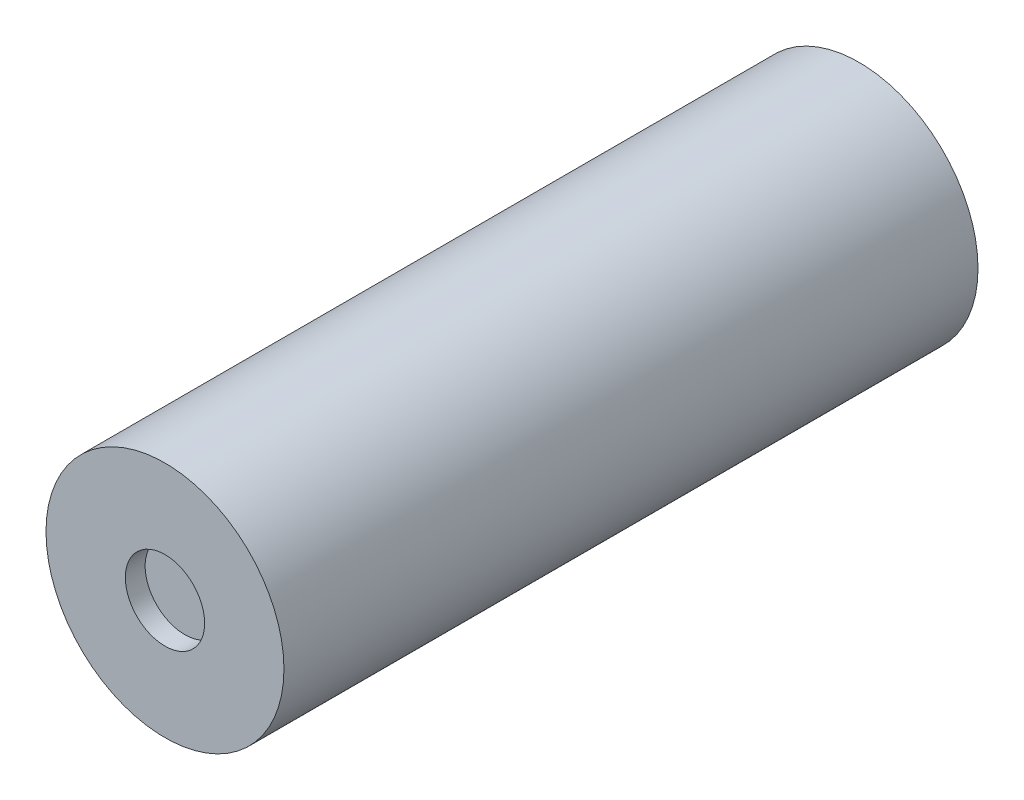
from build123d import *

# Parameters (mm, degrees)
IZIM1_R                     = 30
Y_KSEKLIK_EKSTR_ZYON1_DEPTH = 175
IZIM5_R                     = 10
KES_EKSTR_ZYON1_DEPTH       = 5
L_EK1_SCALE                 = 0.2


with BuildPart() as part:
    # Çizim1 → Yükseklik-Ekstrüzyon1 (new body)
    with BuildSketch(Plane.XY):
        Circle(IZIM1_R)
    extrude(amount=Y_KSEKLIK_EKSTR_ZYON1_DEPTH)

    # Çizim5 → Kes-Ekstrüzyon1 (cut)
    with BuildSketch(Plane.XY.offset(175)):
        Circle(IZIM5_R)
    extrude(amount=-KES_EKSTR_ZYON1_DEPTH, mode=Mode.SUBTRACT)


with BuildPart() as part_1:
    # Ölçek1: scaled about (0, 0, 87.229299363)
    add(part.part.scale(L_EK1_SCALE).moved(Location((0, 0, 69.78343949))))


solid = part_1.part
